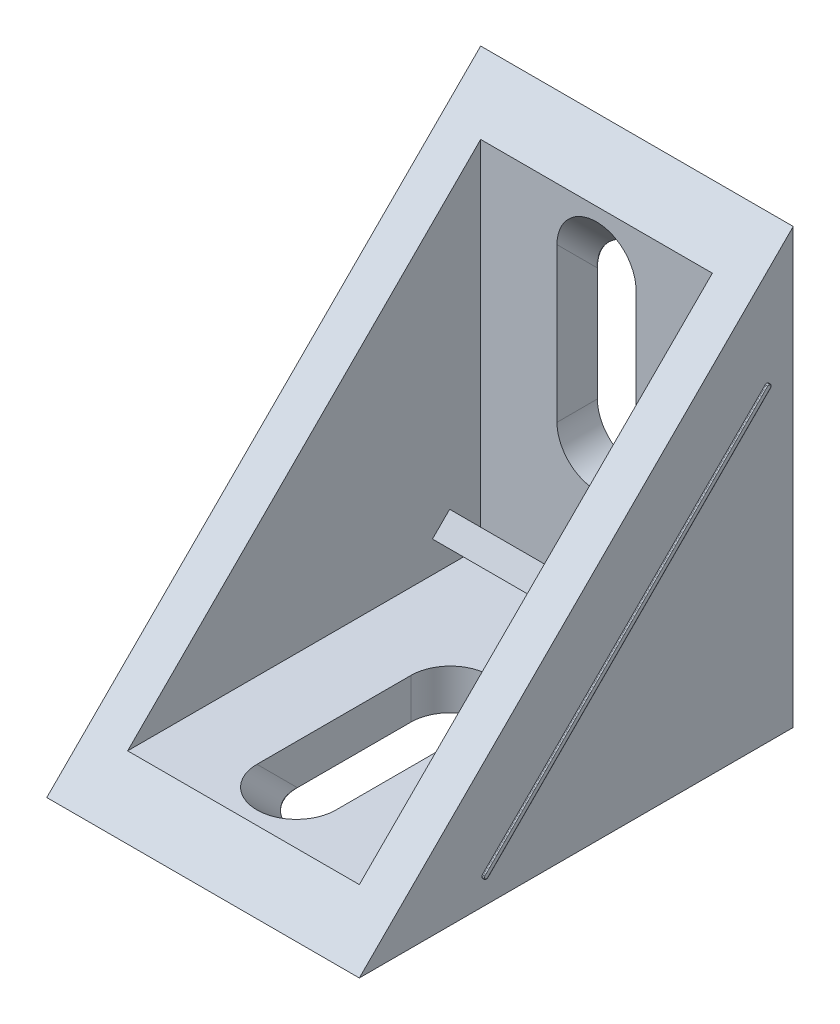
from build123d import *

# Parameters (mm, degrees)
BOSS_EXTRUDE1_DEPTH      = 8.5
BOSS_EXTRUDE1_DEPTH_BACK = 8.5
SHELL1_T                 = -2.2
BOSS_EXTRUDE2_DEPTH      = 0.66
CUT_EXTRUDE1_REACH       = 36.441
CUT_EXTRUDE2_REACH       = 36.441
EXTRUDE_THIN1_DEPTH      = 0.1
FILLET1_R                = 0.127
FILLET2_R                = 0.0508
FILLET1_OF_MIRROR1_R     = 0.127
FILLET2_OF_MIRROR1_R     = 0.0508


with BuildPart() as part:
    # Sketch4 → Boss-Extrude1 (new, two sides: drawn at the far end of the back side and taken through both)
    with BuildSketch(Plane(origin=(0, 0, 0), x_dir=(0, 0, -1), z_dir=(1, 0, 0)).offset(-BOSS_EXTRUDE1_DEPTH_BACK)):
        Polygon((0, 0), (-23.6, 0), (0, 23.6), align=None)
    extrude(amount=BOSS_EXTRUDE1_DEPTH + BOSS_EXTRUDE1_DEPTH_BACK)

    # Shell1
    shell1_openings = [part.faces().sort_by_distance(p)[0] for p in [
        (0, 11.8, 11.8),
    ]]
    offset(amount=SHELL1_T, openings=shell1_openings, kind=Kind.INTERSECTION)

    # Sketch5 → Boss-Extrude2 (add, symmetric)
    with BuildSketch(Plane(origin=(0, 0, 0), x_dir=(1, 0, 0), z_dir=(0, 0.7071067811865477, -0.7071067811865474))):
        Polygon((6.3, -3.111269837), (1.728, -3.111269837), (6.3, -6.159269837), align=None)
        Polygon((-1.728, -3.111269837), (-6.3, -6.159269837), (-6.3, -3.111269837), align=None)
    extrude(amount=BOSS_EXTRUDE2_DEPTH, both=True)

    # Sketch9 → Cut-Extrude1 (cut, up to next)
    with BuildSketch(Plane.XZ, mode=Mode.PRIVATE) as cut_extrude1_sk1:
        with BuildLine():
            Line((-2.15, 10.15), (-2.15, 16.35))
            ThreePointArc((-2.15, 16.35), (0, 18.5), (2.15, 16.35))
            Line((2.15, 16.35), (2.15, 10.15))
            ThreePointArc((2.15, 10.15), (0, 8), (-2.15, 10.15))
        make_face()
    cut_extrude1_tool1 = extrude(cut_extrude1_sk1.sketch, amount=-CUT_EXTRUDE1_REACH, mode=Mode.PRIVATE) & part.part
    add(cut_extrude1_tool1.solids().sort_by_distance((0, 0, 13.25))[0], mode=Mode.SUBTRACT)

    # Cut-Sweep2: sweep along a path in Sketch8
    with BuildLine(Plane(origin=(0, 0, 0), x_dir=(0, 0, -1), z_dir=(1, 0, 0))) as cut_sweep2_path:
        Line((-20.7, 2.2), (-18.5, 0))
    # Sketch10 → Cut-Sweep2 (sweep, cut)
    with BuildSketch(Plane(origin=(0, 2.2, 0), x_dir=(1, 0, 0), z_dir=(0, 1, 0))):
        with BuildLine():
            Line((-2.15, -18.519), (-2.15, -16.35))
            Line((-2.15, -16.35), (2.15, -16.35))
            Line((2.15, -16.35), (2.15, -18.519))
            ThreePointArc((2.15, -18.519), (0, -20.669), (-2.15, -18.519))
        make_face()
    sweep(path=cut_sweep2_path.line, mode=Mode.SUBTRACT)

    # Sketch11 → Cut-Extrude2 (cut, up to next)
    with BuildSketch(Plane(origin=(0, 0, 0), x_dir=(-1, 0, 0), z_dir=(0, 0, -1)), mode=Mode.PRIVATE) as cut_extrude2_sk1:
        with BuildLine():
            Line((-2.15, 16.35), (-2.15, 10.15))
            ThreePointArc((-2.15, 10.15), (0, 8), (2.15, 10.15))
            Line((2.15, 10.15), (2.15, 16.35))
            ThreePointArc((2.15, 16.35), (0, 18.5), (-2.15, 16.35))
        make_face()
    cut_extrude2_tool1 = extrude(cut_extrude2_sk1.sketch, amount=-CUT_EXTRUDE2_REACH, mode=Mode.PRIVATE) & part.part
    add(cut_extrude2_tool1.solids().sort_by_distance((0, 13.25, 0))[0], mode=Mode.SUBTRACT)

    # Cut-Sweep3: sweep along a path in Sketch13
    with BuildLine(Plane(origin=(0, 0, 0), x_dir=(0, 0, -1), z_dir=(1, 0, 0))) as cut_sweep3_path:
        Line((-2.2, 20.7), (0, 18.5))
    # Sketch12 → Cut-Sweep3 (sweep, cut)
    with BuildSketch(Plane.XY.offset(2.2)):
        with BuildLine():
            Line((-2.15, 18.519), (-2.15, 16.35))
            Line((-2.15, 16.35), (2.15, 16.35))
            Line((2.15, 16.35), (2.15, 18.519))
            ThreePointArc((2.15, 18.519), (0, 20.669), (-2.15, 18.519))
        make_face()
    sweep(path=cut_sweep3_path.line, mode=Mode.SUBTRACT)

    # Sketch14 → Extrude-Thin1 (add)
    with BuildSketch(Plane(origin=(8.5, 0, 0), x_dir=(0, 0, -1), z_dir=(1, 0, 0))):
        Polygon((-1.435511644, 16.99186083), (-16.99186083, 1.435511644), (-16.776334683, 1.219985497), (-1.219985497, 16.776334683), align=None)
    extrude_thin1 = extrude(amount=EXTRUDE_THIN1_DEPTH)

    # Fillet1
    fillet1_edges = [part.edges().sort_by_distance(p)[0] for p in [
        (8.55, 16.99186083, 1.435511644),
        (8.55, 1.435511644, 16.99186083),
        (8.55, 1.219985497, 16.776334683),
        (8.55, 16.776334683, 1.219985497),
    ]]
    fillet(fillet1_edges, radius=FILLET1_R)

    # Fillet2
    fillet2_edges = [part.edges().sort_by_distance(p)[0] for p in [
        (8.6, 9.213686237, 9.213686237),
        (8.6, 16.884097757, 1.327748571),
        (8.6, 1.327748571, 16.884097757),
        (8.6, 8.99816009, 8.99816009),
        (8.6, 1.435511644, 16.939255708),
        (8.6, 1.27259062, 16.776334683),
        (8.6, 16.776334683, 1.27259062),
        (8.6, 16.939255708, 1.435511644),
    ]]
    fillet(fillet2_edges, radius=FILLET2_R)

    # Mirror1: Extrude-Thin1 across plane
    add(extrude_thin1.mirror(Plane(origin=(0, 0, 0), x_dir=(0, 0, 1), z_dir=(1, 0, 0))))

    # Fillet1 of Mirror1
    fillet1_of_mirror1_edges = [part.edges().sort_by_distance(p)[0] for p in [
        (-8.55, 16.99186083, 1.435511644),
        (-8.55, 1.435511644, 16.99186083),
        (-8.55, 1.219985497, 16.776334683),
        (-8.55, 16.776334683, 1.219985497),
    ]]
    fillet(fillet1_of_mirror1_edges, radius=FILLET1_OF_MIRROR1_R)

    # Fillet2 of Mirror1
    fillet2_of_mirror1_edges = [part.edges().sort_by_distance(p)[0] for p in [
        (-8.6, 9.213686237, 9.213686237),
        (-8.6, 16.884097757, 1.327748571),
        (-8.6, 1.327748571, 16.884097757),
        (-8.6, 8.99816009, 8.99816009),
        (-8.6, 1.435511644, 16.939255708),
        (-8.6, 1.27259062, 16.776334683),
        (-8.6, 16.776334683, 1.27259062),
        (-8.6, 16.939255708, 1.435511644),
    ]]
    fillet(fillet2_of_mirror1_edges, radius=FILLET2_OF_MIRROR1_R)


solid = part.part
